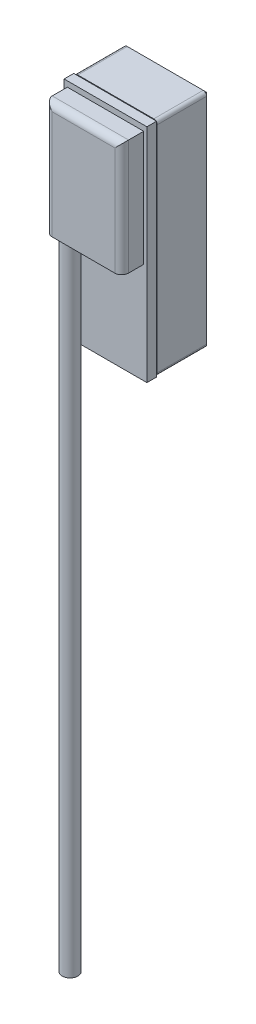
from build123d import *

# Parameters (mm, degrees)
SKETCH_1_W      = 6.02
SKETCH_1_H      = 16.11
EXTRUDE_1_DEPTH = 3.84
SKETCH_2_R      = 0.725
EXTRUDE_2_DEPTH = 0.2
SKETCH_3_W      = 6.02
SKETCH_3_H      = 16.11
EXTRUDE_3_DEPTH = 0.7
SKETCH_4_W      = 5.55
SKETCH_4_H      = 8.38
EXTRUDE_4_DEPTH = 1.6
SKETCH_5_R      = 0.57
EXTRUDE_5_DEPTH = 46.4
FILLET_1_R      = 0.5
FILLET_2_R      = 0.25
CHAMFER_1_SIZE  = 0.25


with BuildPart() as part:
    # Эскиз1 → Бобышка-Вытянуть1 (new body)
    with BuildSketch(Plane.XY):
        Rectangle(SKETCH_1_W, SKETCH_1_H)
    extrude(amount=EXTRUDE_1_DEPTH)

    # Эскиз2 → Бобышка-Вытянуть2 (add)
    with BuildSketch(Plane(origin=(0, 0, 0), x_dir=(-1, 0, 0), z_dir=(0, 0, -1))):
        with Locations((-0.87, 0.795)):
            Circle(SKETCH_2_R)
    extrude(amount=EXTRUDE_2_DEPTH)

    # Скругление2
    fillet_2_edges = [part.edges().sort_by_distance(p)[0] for p in [
        (3.01, -8.055, 1.92),
        (-3.01, -8.055, 1.92),
        (-3.01, 8.055, 1.92),
        (3.01, 8.055, 1.92),
    ]]
    fillet(fillet_2_edges, radius=FILLET_2_R)

    # Фаска1
    chamfer_1_edges = [part.edges().sort_by_distance(p)[0] for p in [
        (0, -8.055, 0),
        (3.01, 0, 0),
        (-3.01, 0, 0),
        (0, 8.055, 0),
        (-2.936776695, 7.981776695, 0),
        (2.936776695, 7.981776695, 0),
        (2.936776695, -7.981776695, 0),
        (-2.936776695, -7.981776695, 0),
    ]]
    chamfer(chamfer_1_edges, length=CHAMFER_1_SIZE)


with BuildPart() as body_2:
    # Эскиз3 → Бобышка-Вытянуть3 (new body)
    with BuildSketch(Plane.XY.offset(3.89)):
        Rectangle(SKETCH_3_W, SKETCH_3_H)
    extrude(amount=EXTRUDE_3_DEPTH)

    # Эскиз4 → Бобышка-Вытянуть4 (add)
    with BuildSketch(Plane.XY.offset(4.59)):
        with Locations((0, 3.465)):
            Rectangle(SKETCH_4_W, SKETCH_4_H)
    extrude(amount=EXTRUDE_4_DEPTH)

    # Эскиз5 → Бобышка-Вытянуть5 (add)
    with BuildSketch(Plane.XZ.offset(0.725)):
        with Locations(Location((-1.775, 5.39, 0), (0, 0, 90))):
            Circle(SKETCH_5_R)
    extrude(amount=EXTRUDE_5_DEPTH)

    # Скругление1
    fillet_1_edges = [body_2.edges().sort_by_distance(p)[0] for p in [
        (2.775, 3.465, 6.19),
        (0, 7.655, 6.19),
        (-2.775, 3.465, 6.19),
    ]]
    fillet(fillet_1_edges, radius=FILLET_1_R)


solid = Compound([part.part, body_2.part])
